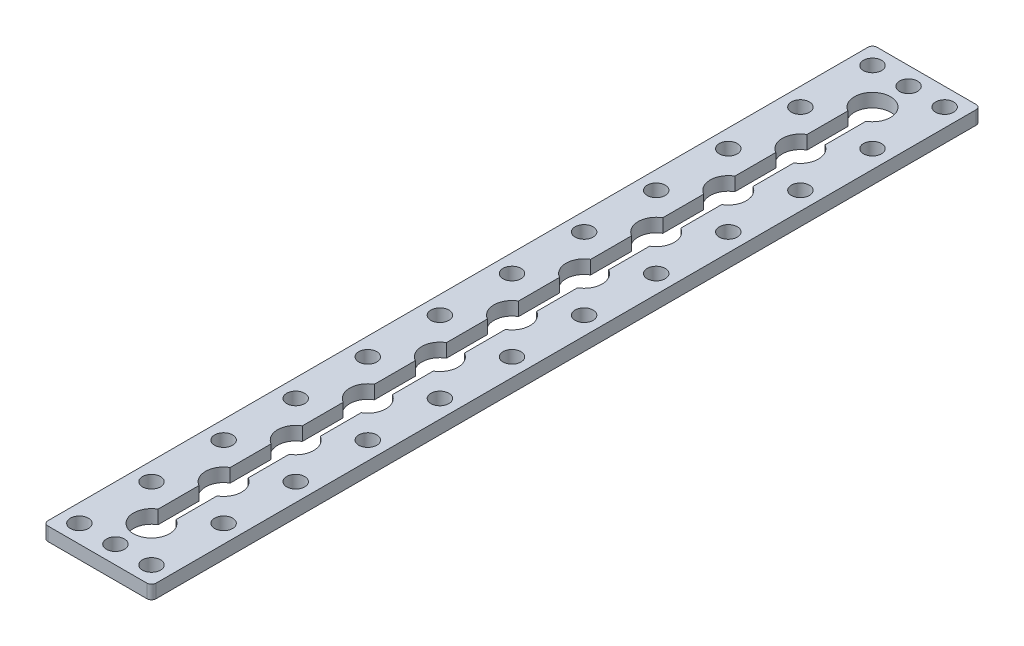
from build123d import *

# Parameters (mm, degrees)
SKETCH1_W                = 24
SKETCH1_H                = 184
BOSS_EXTRUDE1_DEPTH      = 3
F_4_0_4_DIAMETER_HOLE1_D = 4
F_8_0_8_DIAMETER_HOLE1_D = 8
LPATTERN1_COUNT          = 11
LPATTERN1_PITCH          = 16
SKETCH9_W                = 4
SKETCH9_H                = 160
CUT_EXTRUDE1_DEPTH       = 3
FILLET1_R                = 1


with BuildPart() as part:
    # Sketch1 → Boss-Extrude1 (new body)
    with BuildSketch(Plane(origin=(0, 0, 0), x_dir=(1, 0, 0), z_dir=(0, 1, 0))):
        Rectangle(SKETCH1_W, SKETCH1_H)
    extrude(amount=BOSS_EXTRUDE1_DEPTH)

    # Ø4.0 (4) Diameter Hole1 (through all)
    with Locations(Plane(origin=(0, 3, 0), x_dir=(1, 0, 0), z_dir=(0, 1, 0))):
        with Locations((-8, 88), (0, 88), (8, 88), (-8, 72), (-8, 56), (8, 56), (8, 72), (-8, 40), (8, 40), (-8, 24), (-8, 8), (8, 8), (8, 24)):
            f_4_0_4_diameter_hole1 = Hole(F_4_0_4_DIAMETER_HOLE1_D / 2)

    # Mirror1: Ø4.0 (4) Diameter Hole1 across plane
    add(f_4_0_4_diameter_hole1.mirror(Plane.XY), mode=Mode.SUBTRACT)

    # Ø8.0 (8) Diameter Hole1 (through all)
    with Locations(Plane(origin=(0, 3, 0), x_dir=(1, 0, 0), z_dir=(0, 1, 0))):
        with Locations((0, 80)):
            f_8_0_8_diameter_hole1 = Hole(F_8_0_8_DIAMETER_HOLE1_D / 2)

    # LPattern1: Ø8.0 (8) Diameter Hole1 ×11
    with Locations(*[(0, 0, i * LPATTERN1_PITCH) for i in range(1, LPATTERN1_COUNT)]):
        add(f_8_0_8_diameter_hole1, mode=Mode.SUBTRACT)

    # Sketch9 → Cut-Extrude1 (cut)
    with BuildSketch(Plane(origin=(0, 3, 0), x_dir=(1, 0, 0), z_dir=(0, 1, 0))):
        Rectangle(SKETCH9_W, SKETCH9_H)
    extrude(amount=-CUT_EXTRUDE1_DEPTH, mode=Mode.SUBTRACT)

    # Fillet1
    fillet1_edges = [part.edges().sort_by_distance(p)[0] for p in [
        (-12, 1.5, -92),
        (12, 1.5, -92),
        (12, 1.5, 92),
        (-12, 1.5, 92),
    ]]
    fillet(fillet1_edges, radius=FILLET1_R)


solid = part.part
